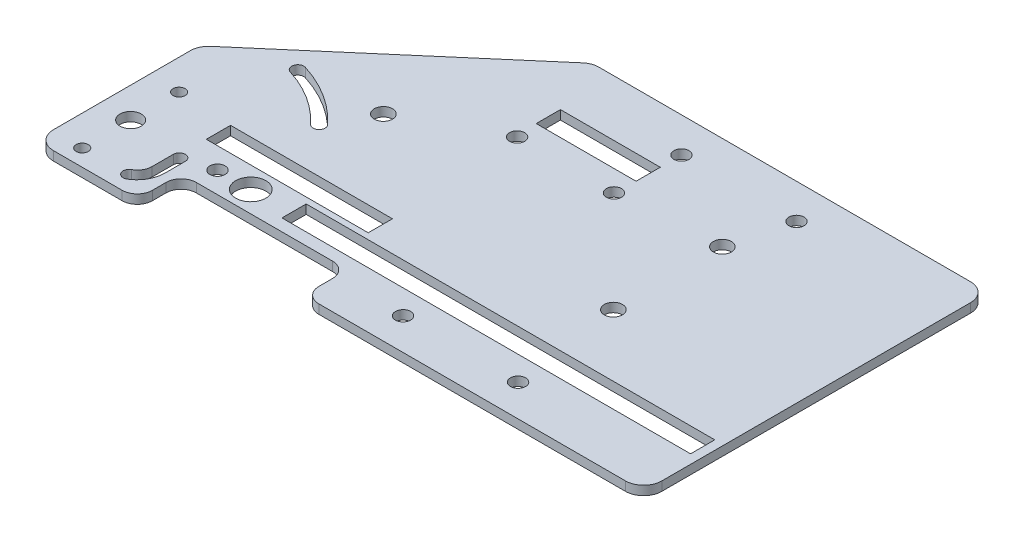
from build123d import *

# Parameters (mm, degrees)
SKETCH_1_W          = 220
SKETCH_1_H          = 114
SKETCH_1_R          = 2.5
SKETCH_1_R_2        = 3
SKETCH_1_R_3        = 5
SKETCH_1_R_4        = 2
SKETCH_1_R_5        = 3.5
SKETCH_1_W_2        = 135
SKETCH_1_H_2        = 8
SKETCH_1_W_3        = 53.5
SKETCH_1_W_4        = 33
EXTRUDE_1_DEPTH     = 1.5
SKETCH_2_W          = 55
SKETCH_2_H          = 14.5
CUT_EXTRUDE_1_DEPTH = 248.800322841
FILLET_1_R          = 5
SKETCH_3_W          = 19
SKETCH_3_H          = 114
CUT_EXTRUDE_2_DEPTH = 248.800322841
FILLET_2_R          = 6


with BuildPart() as part:
    # 草图1 → 凸台-拉伸1 (new, symmetric)
    with BuildSketch(Plane(origin=(0, 0, 0), x_dir=(1, 0, 0), z_dir=(0, 1, 0))):
        with Locations((-110, 57)):
            Rectangle(SKETCH_1_W, SKETCH_1_H)
        with Locations(Location((-71, 102.5, 0), (0, 0, 270))):
            Circle(SKETCH_1_R, mode=Mode.SUBTRACT)
        with Locations(Location((-109, 102.5, 0), (0, 0, 270))):
            Circle(SKETCH_1_R, mode=Mode.SUBTRACT)
        with Locations(Location((-141.312887166, 80.5, 0), (0, 0, 270))):
            Circle(SKETCH_1_R, mode=Mode.SUBTRACT)
        with Locations(Location((-109.312887166, 80.5, 0), (0, 0, 270))):
            Circle(SKETCH_1_R, mode=Mode.SUBTRACT)
        with Locations(Location((-109, 10.5, 0), (0, 0, 270))):
            Circle(SKETCH_1_R, mode=Mode.SUBTRACT)
        with Locations(Location((-71, 10.5, 0), (0, 0, 270))):
            Circle(SKETCH_1_R, mode=Mode.SUBTRACT)
        with Locations(Location((-76, 47, 0), (0, 0, 270))):
            Circle(SKETCH_1_R_2, mode=Mode.SUBTRACT)
        with Locations(Location((-76, 83, 0), (0, 0, 270))):
            Circle(SKETCH_1_R_2, mode=Mode.SUBTRACT)
        with Locations(Location((-170, 65, 0), (0, 0, 270))):
            Circle(SKETCH_1_R_2, mode=Mode.SUBTRACT)
        with Locations(Location((-170.312887166, 21.5, 0), (0, 0, 270))):
            Circle(SKETCH_1_R_3, mode=Mode.SUBTRACT)
        with Locations(Location((-181.312887166, 21.5, 0), (0, 0, 270))):
            Circle(SKETCH_1_R, mode=Mode.SUBTRACT)
        with Locations(Location((-210.002887166, 37.50000026, 0), (0, 0, 270))):
            Circle(SKETCH_1_R_4, mode=Mode.SUBTRACT)
        with Locations(Location((-210.002887166, 5.5, 0), (0, 0, 270))):
            Circle(SKETCH_1_R_4, mode=Mode.SUBTRACT)
        with Locations(Location((-210.002887166, 21.5, 0), (0, 0, 270))):
            Circle(SKETCH_1_R_5, mode=Mode.SUBTRACT)
        with BuildLine():
            Line((-193.157887166, 18.743662964), (-193.157887166, 11.743662964))
            ThreePointArc((-193.157887166, 11.743662964), (-193.836926328, 9.268099132), (-195.683983559, 7.485435381))
            ThreePointArc((-195.683983559, 7.485435381), (-196.460455274, 4.734904062), (-193.694496162, 4.015320115))
            ThreePointArc((-193.694496162, 4.015320115), (-190.370630742, 7.428094707), (-189.157887166, 12.035085564))
            Line((-189.157887166, 12.035085564), (-189.157887166, 18.743662964))
            ThreePointArc((-189.157887166, 18.743662964), (-191.157887166, 20.743662964), (-193.157887166, 18.743662964))
        make_face(mode=Mode.SUBTRACT)
        with Locations((-89.5, 22.5)):
            Rectangle(SKETCH_1_W_2, SKETCH_1_H_2, mode=Mode.SUBTRACT)
        with Locations((-165.25, 32.5)):
            Rectangle(SKETCH_1_W_3, SKETCH_1_H_2, mode=Mode.SUBTRACT)
        with Locations((-125.5, 91.5)):
            Rectangle(SKETCH_1_W_4, SKETCH_1_H_2, mode=Mode.SUBTRACT)
        with BuildLine():
            ThreePointArc((-196.226976492, 65.454109411), (-198.733501828, 64.143639747), (-197.423032164, 61.637114411))
            ThreePointArc((-197.423032164, 61.637114411), (-187.463332326, 57.014316596), (-179.039469146, 49.971276796))
            ThreePointArc((-179.039469146, 49.971276796), (-176.213519698, 49.852914148), (-176.09515705, 52.678863596))
            ThreePointArc((-176.09515705, 52.678863596), (-185.320120262, 60.391688659), (-196.226976492, 65.454109411))
        make_face(mode=Mode.SUBTRACT)
    extrude(amount=EXTRUDE_1_DEPTH, both=True)

    # 草图2 → 切除-拉伸1 (cut, through all)
    with BuildSketch(Plane(origin=(0, 1.5, 0), x_dir=(1, 0, 0), z_dir=(0, 1, 0))):
        with Locations((-158.812887166, 7.25)):
            Rectangle(SKETCH_2_W, SKETCH_2_H)
    extrude(amount=-CUT_EXTRUDE_1_DEPTH, mode=Mode.SUBTRACT)

    # 圆角1
    fillet_1_edges = [part.edges().sort_by_distance(p)[0] for p in [
        (-186.312887166, 0, 0),
        (-186.312887166, 0, -14.5),
        (-131.312887166, 0, -14.5),
        (-131.312887166, 0, 0),
    ]]
    fillet(fillet_1_edges, radius=FILLET_1_R)

    # 草图3 → 切除-拉伸2 (cut, through all)
    with BuildSketch(Plane(origin=(0, 1.5, 0), x_dir=(1, 0, 0), z_dir=(0, 1, 0))):
        Polygon((-220, 54), (-150, 114), (-220, 114), align=None)
        with Locations((-9.5, 57)):
            Rectangle(SKETCH_3_W, SKETCH_3_H)
    extrude(amount=-CUT_EXTRUDE_2_DEPTH, mode=Mode.SUBTRACT)

    # 圆角2
    fillet_2_edges = [part.edges().sort_by_distance(p)[0] for p in [
        (-220, 0, -54),
        (-150, 0, -114),
        (-19, 0, 0),
        (-19, 0, -114),
        (-220, 0, 0),
    ]]
    fillet(fillet_2_edges, radius=FILLET_2_R)


solid = part.part
